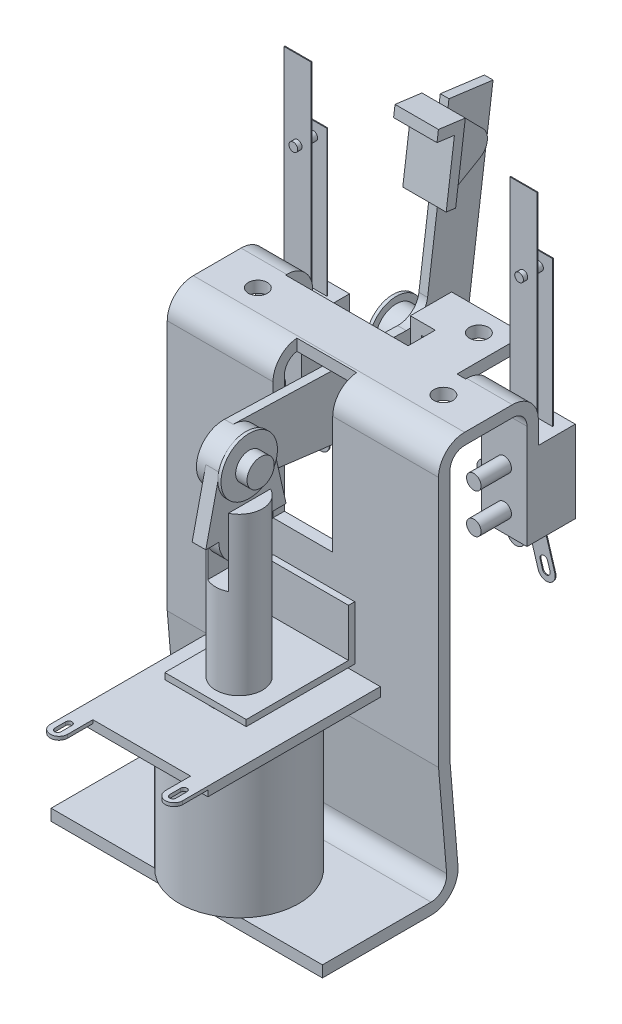
from build123d import *
from build123d.topology import SkipClean

# Parameters (mm, degrees)
BOSS_EXTRUDE1_DEPTH       = 31.75
SKETCH2_W                 = 13.97
SKETCH2_H                 = 33.655
CUT_EXTRUDE1_DEPTH        = 5.588
SKETCH3_W                 = 42.164
SKETCH3_H                 = 30.48
CUT_EXTRUDE2_DEPTH        = 6.35
SKETCH4_W                 = 11.43
SKETCH4_H                 = 2.667
BOSS_EXTRUDE2_DEPTH       = 16.002
SKETCH5_W                 = 9.652
SKETCH5_H                 = 2.667
BOSS_EXTRUDE3_DEPTH       = 5.842
SKETCH6_W                 = 2.667
SKETCH6_H                 = 9.652
BOSS_EXTRUDE4_DEPTH       = 11.303
HOLE1_D                   = 4.445
BOSS_EXTRUDE5_DEPTH       = 1.016
SKETCH8_R                 = 3.96875
BOSS_EXTRUDE6_DEPTH       = 0.762
SKETCH9_R                 = 4.826
BOSS_EXTRUDE7_DEPTH       = 5.334
SKETCH10_R                = 3.048
BOSS_EXTRUDE8_DEPTH       = 2.54
SKETCH11_R                = 6.35
BOSS_EXTRUDE9_DEPTH       = 0.762
BOSS_EXTRUDE10_DEPTH      = 2.54
BOSS_EXTRUDE11_DEPTH      = 5.08
BOSS_EXTRUDE12_DEPTH      = 3.2004
SKETCH18_R                = 3.175
BOSS_EXTRUDE13_DEPTH      = 3.429
SKETCH19_R                = 6.604
BOSS_EXTRUDE14_DEPTH      = 0.762
BOSS_EXTRUDE15_DEPTH      = 31.1912
BOSS_EXTRUDE15_DEPTH_BACK = 5.588
SKETCH20_R                = 5.4864
SKETCH21_W                = 10.9728
SKETCH21_H                = 15.875
CUT_EXTRUDE3_DEPTH        = 2.413
SKETCH22_W                = 19.05
SKETCH22_H                = 25.4
BOSS_EXTRUDE16_DEPTH      = 1.4605
SKETCH23_W                = 19.05
SKETCH23_H                = 1.4605
BOSS_EXTRUDE17_DEPTH      = 11.176
SKETCH24_R                = 6.35
BOSS_EXTRUDE18_DEPTH      = 1.5875
SKETCH26_W                = 30.988
SKETCH26_H                = 40.3352
BOSS_EXTRUDE19_DEPTH      = 2.1717
SKETCH27_R                = 13.97
BOSS_EXTRUDE20_DEPTH      = 33.818160552
SKETCH28_R                = 4.3434
BOSS_EXTRUDE21_DEPTH      = 2.032
BOSS_EXTRUDE22_DEPTH      = 0.8001
SKETCH30_W                = 10.668
SKETCH30_H                = 19.177
BOSS_EXTRUDE23_DEPTH      = 8.636
SKETCH31_W                = 6.35
SKETCH31_H                = 49.276
BOSS_EXTRUDE24_DEPTH      = 0.2032
SKETCH32_W                = 6.35
SKETCH32_H                = 34.036
BOSS_EXTRUDE25_DEPTH      = 0.2032
BOSS_EXTRUDE29_DEPTH      = 1.016
BOSS_EXTRUDE29_DEPTH_BACK = 4.8768
SKETCH37_R                = 1.016
BOSS_EXTRUDE26_DEPTH      = 0.2032
BOSS_EXTRUDE27_DEPTH      = 0.2032
BOSS_EXTRUDE28_DEPTH      = 0.2032
SKETCH40_R                = 1.7018
BOSS_EXTRUDE30_DEPTH      = 7.112
LPATTERN1_COUNT           = 2
LPATTERN1_PITCH           = 52.832


with BuildPart() as part:
    # Sketch1 → Boss-Extrude1 (new, symmetric)
    with BuildSketch(Plane(origin=(0, 0, 0), x_dir=(0, 0, -1), z_dir=(1, 0, 0))):
        with BuildLine():
            Line((0, 0), (25.423030806, 0))
            ThreePointArc((25.423030806, 0), (30.080839021, 2.044988132), (31.727675559, 6.858))
            Line((31.727675559, 6.858), (29.845, 29.21))
            Line((29.845, 29.21), (29.845, 87.884))
            ThreePointArc((29.845, 87.884), (30.849330847, 90.308669153), (33.274, 91.313))
            Line((33.274, 91.313), (44.45, 91.313))
            ThreePointArc((44.45, 91.313), (46.874669153, 90.308669153), (47.879, 87.884))
            Line((47.879, 87.884), (47.879, 63.5))
            Line((47.879, 63.5), (50.546, 63.5))
            Line((50.546, 63.5), (50.546, 87.884))
            ThreePointArc((50.546, 87.884), (48.760522938, 92.194522938), (44.45, 93.98))
            Line((44.45, 93.98), (33.274, 93.98))
            ThreePointArc((33.274, 93.98), (28.963477062, 92.194522938), (27.178, 87.884))
            Line((27.178, 87.884), (27.178, 29.097879794))
            Line((27.178, 29.097879794), (29.070085955, 6.634155199))
            ThreePointArc((29.070085955, 6.634155199), (28.117438516, 3.849966652), (25.423030806, 2.667))
            Line((25.423030806, 2.667), (0, 2.667))
            Line((0, 2.667), (0, 0))
        make_face()
    extrude(amount=BOSS_EXTRUDE1_DEPTH, both=True)

    # Sketch2 → Cut-Extrude1 (cut)
    with BuildSketch(Plane.XY.offset(-27.178)):
        with Locations((0, 77.1525)):
            Rectangle(SKETCH2_W, SKETCH2_H)
    extrude(amount=-CUT_EXTRUDE1_DEPTH, mode=Mode.SUBTRACT)

    # Sketch3 → Cut-Extrude2 (cut)
    with BuildSketch(Plane(origin=(0, 0, -50.546), x_dir=(-1, 0, 0), z_dir=(0, 0, -1))):
        with Locations((0, 78.74)):
            Rectangle(SKETCH3_W, SKETCH3_H)
    extrude(amount=-CUT_EXTRUDE2_DEPTH, mode=Mode.SUBTRACT)

    # Sketch4 → Boss-Extrude2 (add)
    with BuildSketch(Plane(origin=(0, 0, -44.196), x_dir=(-1, 0, 0), z_dir=(0, 0, -1))):
        with Locations((-13.335, 92.6465)):
            Rectangle(SKETCH4_W, SKETCH4_H)
    extrude(amount=BOSS_EXTRUDE2_DEPTH)

    # Sketch5 → Boss-Extrude3 (add)
    with BuildSketch(Plane.ZY.offset(-7.62)):
        with Locations((-55.372, 92.6465)):
            Rectangle(SKETCH5_W, SKETCH5_H)
    extrude(amount=BOSS_EXTRUDE3_DEPTH)

    # Sketch6 → Boss-Extrude4 (add)
    with BuildSketch(Plane.XZ.offset(-91.313)):
        with Locations((3.1115, -55.372)):
            Rectangle(SKETCH6_W, SKETCH6_H)
    extrude(amount=BOSS_EXTRUDE4_DEPTH)

    # Hole1 (through all)
    with Locations(Plane(origin=(0, 93.98, 0), x_dir=(1, 0, 0), z_dir=(0, 1, 0))):
        with Locations((13.2588, 55.118), (21.717, 38.354), (-21.717, 38.354)):
            Hole(HOLE1_D / 2)



with BuildPart() as body_2:
    # Sketch7 → Boss-Extrude5 (new, symmetric)
    with BuildSketch(Plane(origin=(0, 0, 0), x_dir=(0, 0, -1), z_dir=(1, 0, 0))):
        with BuildLine():
            Line((9.838635771, 91.94294016), (50.356622983, 90.672956452))
            ThreePointArc((50.356622983, 90.672956452), (53.669416299, 91.830949239), (55.349742198, 94.91186659))
            Line((55.349742198, 94.91186659), (60.352799396, 132.681952884))
            Line((60.352799396, 132.681952884), (70.676622983, 131.314450583))
            Line((70.676622983, 131.314450583), (64.105941196, 81.70973725))
            ThreePointArc((64.105941196, 81.70973725), (60.526398694, 75.500087693), (53.609896572, 73.619962553))
            Line((53.609896572, 73.619962553), (8.841804116, 79.282121598))
            ThreePointArc((8.841804116, 79.282121598), (3.302, 86.087941592), (9.838635771, 91.94294016))
        make_face()
    extrude(amount=BOSS_EXTRUDE5_DEPTH, both=True)


with BuildPart() as part_1:
    add(part.part)

    add(body_2.part)  # Boss-Extrude6 merges body 2
    # Sketch8 → Boss-Extrude6 (add)
    with BuildSketch(Plane(origin=(1.016, 0, 0), x_dir=(0, 0, -1), z_dir=(1, 0, 0))):
        with Locations(Location((55.372, 85.09, 0), (0, 0, 180))):
            Circle(SKETCH8_R)
    extrude(amount=BOSS_EXTRUDE6_DEPTH)

    # Sketch9 → Boss-Extrude7 (add)
    with BuildSketch(Plane.ZY.offset(1.016)):
        with Locations((-55.372, 85.09)):
            Circle(SKETCH9_R)
    extrude(amount=BOSS_EXTRUDE7_DEPTH)

    # Sketch10 → Boss-Extrude8 (add)
    with BuildSketch(Plane.ZY.offset(6.35)):
        with Locations((-55.372, 85.09)):
            Circle(SKETCH10_R)
    extrude(amount=BOSS_EXTRUDE8_DEPTH)

    # Sketch11 → Boss-Extrude9 (add)
    with BuildSketch(Plane.ZY.offset(6.35)):
        with Locations(Location((-55.372, 85.09, 0), (0, 0, 180))):
            Circle(SKETCH11_R)
    extrude(amount=BOSS_EXTRUDE9_DEPTH)

    # Sketch14 → Boss-Extrude10 (add, symmetric)
    with BuildSketch(Plane(origin=(0, 0, 0), x_dir=(0, 0, -1), z_dir=(1, 0, 0))):
        with BuildLine():
            Line((60.119323394, 130.919348857), (57.851270797, 113.796909737))
            Line((57.851270797, 113.796909737), (66.075528996, 118.600546255))
            ThreePointArc((66.075528996, 118.600546255), (67.798317231, 121.190749284), (66.809310718, 124.140158911))
            Line((66.809310718, 124.140158911), (60.119323394, 130.919348857))
        make_face()
    extrude(amount=BOSS_EXTRUDE10_DEPTH, both=True)

    # Sketch16 → Boss-Extrude11 (add, symmetric)
    with BuildSketch(Plane(origin=(0, 0, 0), x_dir=(0, 0, -1), z_dir=(1, 0, 0))):
        Polygon((57.851270797, 113.796909737), (55.635425734, 114.090422426), (57.569941184, 128.694855793), (53.490771865, 129.23518597), (53.824309011, 131.753191723), (60.119323394, 130.919348857), align=None)
    extrude(amount=BOSS_EXTRUDE11_DEPTH, both=True)



with BuildPart() as body_2_2:
    # Sketch17 → Boss-Extrude12 (new body)
    with BuildSketch(Plane(origin=(1.016, 0, 0), x_dir=(0, 0, -1), z_dir=(1, 0, 0))):
        with BuildLine():
            Line((0.241478799, 72.896060552), (3.289478799, 72.896060552))
            ThreePointArc((3.289478799, 72.896060552), (9.639478799, 66.546060552), (15.989478799, 72.896060552))
            Line((15.989478799, 72.896060552), (19.037478799, 72.896060552))
            Line((19.037478799, 72.896060552), (15.839053038, 86.995344025))
            ThreePointArc((15.839053038, 86.995344025), (9.639478799, 91.946060552), (3.43990456, 86.995344025))
            Line((3.43990456, 86.995344025), (0.241478799, 72.896060552))
        make_face()
    extrude(amount=BOSS_EXTRUDE12_DEPTH)

    # Sketch18 → Boss-Extrude13 (add)
    with BuildSketch(Plane(origin=(4.2164, 0, 0), x_dir=(0, 0, -1), z_dir=(1, 0, 0))):
        with Locations(Location((9.639478799, 85.596060552, 0), (0, 0, 180))):
            Circle(SKETCH18_R)
    extrude(amount=BOSS_EXTRUDE13_DEPTH)

    # Sketch19 → Boss-Extrude14 (add)
    with BuildSketch(Plane(origin=(4.2164, 0, 0), x_dir=(0, 0, -1), z_dir=(1, 0, 0))):
        with Locations(Location((9.639478799, 85.596060552, 0), (0, 0, 182.985743201))):
            Circle(SKETCH19_R)
    extrude(amount=BOSS_EXTRUDE14_DEPTH)


with BuildPart() as body_3:
    # Sketch20 → Boss-Extrude15 (new, two sides: drawn at the far end of the back side and taken through both)
    with BuildSketch(Plane.XZ.offset(-72.896060552).offset(-BOSS_EXTRUDE15_DEPTH_BACK)):
        with Locations(Location((2.6162, -9.639478799, 0), (0, 0, 270))):
            Circle(SKETCH20_R)
    extrude(amount=BOSS_EXTRUDE15_DEPTH + BOSS_EXTRUDE15_DEPTH_BACK)

    # Sketch21 → Cut-Extrude3 (cut, symmetric)
    with BuildSketch(Plane(origin=(2.6162, 0, 0), x_dir=(0, 0, -1), z_dir=(1, 0, 0))):
        with Locations((9.639478799, 70.546560552)):
            Rectangle(SKETCH21_W, SKETCH21_H)
    extrude(amount=CUT_EXTRUDE3_DEPTH, both=True, mode=Mode.SUBTRACT)


with BuildPart() as part_2:
    add(part_1.part)

    add(body_3.part)  # Boss-Extrude16 merges body 3
    # Sketch22 → Boss-Extrude16 (add)
    with BuildSketch(Plane.XZ.offset(-41.704860552)):
        with Locations((2.6162, -14.478)):
            Rectangle(SKETCH22_W, SKETCH22_H)
    extrude(amount=BOSS_EXTRUDE16_DEPTH)

    # Sketch23 → Boss-Extrude17 (add)
    with BuildSketch(Plane.XZ.offset(-41.704860552)):
        with Locations((2.6162, -26.44775)):
            Rectangle(SKETCH23_W, SKETCH23_H)
    extrude(amount=-BOSS_EXTRUDE17_DEPTH)

    # Sketch24 → Boss-Extrude18 (add)
    with BuildSketch(Plane.XZ.offset(-40.244360552)):
        with Locations(Location((2.6162, -9.639478799, 0), (0, 0, 270))):
            Circle(SKETCH24_R)
    extrude(amount=BOSS_EXTRUDE18_DEPTH)



with BuildPart() as body_3_2:
    # Sketch26 → Boss-Extrude19 (new body)
    with BuildSketch(Plane.XZ.offset(-38.656860552)):
        with Locations((2.6162, -7.0104)):
            Rectangle(SKETCH26_W, SKETCH26_H)
    extrude(amount=BOSS_EXTRUDE19_DEPTH)


with BuildPart() as part_3:
    add(part_2.part)

    add(body_3_2.part)  # Boss-Extrude20 merges body 3 2
    # Sketch27 → Boss-Extrude20 (add)
    with BuildSketch(Plane(origin=(0, 36.485160552, 0), x_dir=(-1, 0, 0), z_dir=(0, -1, 0))):
        with Locations(Location((-2.6162, 9.639478799, 0), (0, 0, 223.63112201))):
            Circle(SKETCH27_R)
    extrude(amount=BOSS_EXTRUDE20_DEPTH)

    # Sketch28 → Boss-Extrude21 (add)
    with BuildSketch(Plane.XZ):
        with Locations(Location((2.6162, -9.639478799, 0), (0, 0, 90))):
            Circle(SKETCH28_R)
    extrude(amount=BOSS_EXTRUDE21_DEPTH)

    # Sketch29 → Boss-Extrude22 (add)
    # profile 1 of 2: a face of its own
    with BuildSketch(Plane(origin=(0, 38.656860552, 0), x_dir=(1, 0, 0), z_dir=(0, 1, 0))):
        with BuildLine():
            Line((-12.8778, -13.1572), (-8.8138, -13.1572))
            Line((-8.8138, -13.1572), (-8.8138, -19.0627))
            ThreePointArc((-8.8138, -19.0627), (-10.8458, -21.0947), (-12.8778, -19.0627))
            Line((-12.8778, -19.0627), (-12.8778, -13.1572))
        make_face()
        with BuildLine():
            Line((-11.5824, -16.7513), (-11.5824, -19.3421))
            ThreePointArc((-11.5824, -19.3421), (-10.8458, -20.0787), (-10.1092, -19.3421))
            Line((-10.1092, -19.3421), (-10.1092, -16.7513))
            ThreePointArc((-10.1092, -16.7513), (-10.8458, -16.0147), (-11.5824, -16.7513))
        make_face(mode=Mode.SUBTRACT)
    # profile 2 of 2: a face of its own
    with BuildSketch(Plane(origin=(0, 38.656860552, 0), x_dir=(1, 0, 0), z_dir=(0, 1, 0))):
        with BuildLine():
            Line((14.0462, -13.1572), (14.0462, -19.0627))
            ThreePointArc((14.0462, -19.0627), (16.0782, -21.0947), (18.1102, -19.0627))
            Line((18.1102, -19.0627), (18.1102, -13.1572))
            Line((18.1102, -13.1572), (14.0462, -13.1572))
        make_face()
        with BuildLine():
            Line((15.3416, -16.7513), (15.3416, -19.3421))
            ThreePointArc((15.3416, -19.3421), (16.0782, -20.0787), (16.8148, -19.3421))
            Line((16.8148, -19.3421), (16.8148, -16.7513))
            ThreePointArc((16.8148, -16.7513), (16.0782, -16.0147), (15.3416, -16.7513))
        make_face(mode=Mode.SUBTRACT)
    extrude(amount=-BOSS_EXTRUDE22_DEPTH)

    # Sketch40 → Boss-Extrude30 (add)
    with BuildSketch(Plane.XY.offset(-47.879)):
        with Locations(Location((26.416, 77.5335, 0), (0, 0, 90))):
            Circle(SKETCH40_R)
        with Locations(Location((26.416, 68.2625, 0), (0, 0, 90))):
            Circle(SKETCH40_R)
        with Locations(Location((-26.416, 77.5335, 0), (0, 0, 180))):
            Circle(SKETCH40_R)
        with Locations(Location((-26.416, 68.2625, 0), (0, 0, 180))):
            Circle(SKETCH40_R)
    extrude(amount=BOSS_EXTRUDE30_DEPTH)


with BuildPart() as body_3_3:
    # Sketch30 → Boss-Extrude23 (new body)
    with BuildSketch(Plane(origin=(0, 0, -50.546), x_dir=(-1, 0, 0), z_dir=(0, 0, -1))):
        with Locations((-26.416, 73.0885)):
            Rectangle(SKETCH30_W, SKETCH30_H)
    extrude(amount=BOSS_EXTRUDE23_DEPTH)

    # Sketch31 → Boss-Extrude24 (add)
    with BuildSketch(Plane(origin=(0, 0, -52.3748), x_dir=(-1, 0, 0), z_dir=(0, 0, -1))):
        with Locations((-26.416, 107.315)):
            Rectangle(SKETCH31_W, SKETCH31_H)
    extrude(amount=BOSS_EXTRUDE24_DEPTH)

    # Sketch32 → Boss-Extrude25 (add)
    with BuildSketch(Plane(origin=(0, 0, -56.0324), x_dir=(-1, 0, 0), z_dir=(0, 0, -1))):
        with Locations((-26.416, 99.695)):
            Rectangle(SKETCH32_W, SKETCH32_H)
    extrude(amount=BOSS_EXTRUDE25_DEPTH)

    # Sketch37 → Boss-Extrude29 (add, two sides: drawn at the far end of the back side and taken through both)
    with BuildSketch(Plane(origin=(0, 0, -56.2356), x_dir=(-1, 0, 0), z_dir=(0, 0, -1)).offset(-BOSS_EXTRUDE29_DEPTH_BACK)):
        with Locations(Location((-26.416, 113.665, 0), (0, 0, 180))):
            Circle(SKETCH37_R)
    extrude(amount=BOSS_EXTRUDE29_DEPTH + BOSS_EXTRUDE29_DEPTH_BACK)

    # Sketch34 → Boss-Extrude26 (add)
    with BuildSketch(Plane(origin=(0, 0, -52.3748), x_dir=(-1, 0, 0), z_dir=(0, 0, -1))):
        with BuildLine():
            Line((-31.75, 63.5), (-33.757764131, 56.890908684))
            ThreePointArc((-33.757764131, 56.890908684), (-32.404144553, 54.356), (-29.869235869, 55.709619579))
            Line((-29.869235869, 55.709619579), (-27.502610015, 63.5))
            Line((-27.502610015, 63.5), (-31.75, 63.5))
        make_face()
        with BuildLine():
            Line((-32.086699721, 58.546773264), (-32.644120518, 56.71187399))
            ThreePointArc((-32.644120518, 56.71187399), (-32.034991707, 55.571165082), (-30.894282799, 56.180293892))
            Line((-30.894282799, 56.180293892), (-30.336862003, 58.015193166))
            ThreePointArc((-30.336862003, 58.015193166), (-30.945990813, 59.155902074), (-32.086699721, 58.546773264))
        make_face(mode=Mode.SUBTRACT)
    extrude(amount=BOSS_EXTRUDE26_DEPTH)

    # Sketch35 → Boss-Extrude27 (add)
    with BuildSketch(Plane(origin=(0, 0, -56.0324), x_dir=(-1, 0, 0), z_dir=(0, 0, -1))):
        with BuildLine():
            Line((-25.329389985, 63.5), (-21.082, 63.5))
            Line((-21.082, 63.5), (-19.074235869, 56.890908684))
            ThreePointArc((-19.074235869, 56.890908684), (-20.427855447, 54.356), (-22.962764131, 55.709619579))
            Line((-22.962764131, 55.709619579), (-25.329389985, 63.5))
        make_face()
        with BuildLine():
            Line((-20.745300279, 58.546773264), (-20.187879482, 56.71187399))
            ThreePointArc((-20.187879482, 56.71187399), (-20.797008293, 55.571165082), (-21.937717201, 56.180293892))
            Line((-21.937717201, 56.180293892), (-22.495137997, 58.015193166))
            ThreePointArc((-22.495137997, 58.015193166), (-21.886009187, 59.155902074), (-20.745300279, 58.546773264))
        make_face(mode=Mode.SUBTRACT)
    extrude(amount=BOSS_EXTRUDE27_DEPTH)

    # Sketch36 → Boss-Extrude28 (add)
    with BuildSketch(Plane(origin=(0, 0, -54.2036), x_dir=(-1, 0, 0), z_dir=(0, 0, -1))):
        with BuildLine():
            Line((-21.082, 65.7352), (-15.748, 65.7352))
            ThreePointArc((-15.748, 65.7352), (-13.716, 67.7672), (-15.748, 69.7992))
            Line((-15.748, 69.7992), (-21.082, 69.7992))
            Line((-21.082, 69.7992), (-21.082, 65.7352))
        make_face()
        with BuildLine():
            Line((-18.1991, 66.8528), (-16.2179, 66.8528))
            ThreePointArc((-16.2179, 66.8528), (-15.3035, 67.7672), (-16.2179, 68.6816))
            Line((-16.2179, 68.6816), (-18.1991, 68.6816))
            ThreePointArc((-18.1991, 68.6816), (-19.1135, 67.7672), (-18.1991, 66.8528))
        make_face(mode=Mode.SUBTRACT)
    extrude(amount=BOSS_EXTRUDE28_DEPTH)


with BuildPart() as lpattern1_1:
    # LPattern1: pattern copy
    add(body_3_3.part.moved(Location(Vector(-1, 0, 0) * (1 * LPATTERN1_PITCH))))


with BuildPart() as body_2_2_1:
    add(body_2_2.part)

    # Combine1: union body 3 3, part, LPattern1_1
    add(body_3_3.part)
    add(part_3.part)
    add(lpattern1_1.part)


solid = body_2_2_1.part
